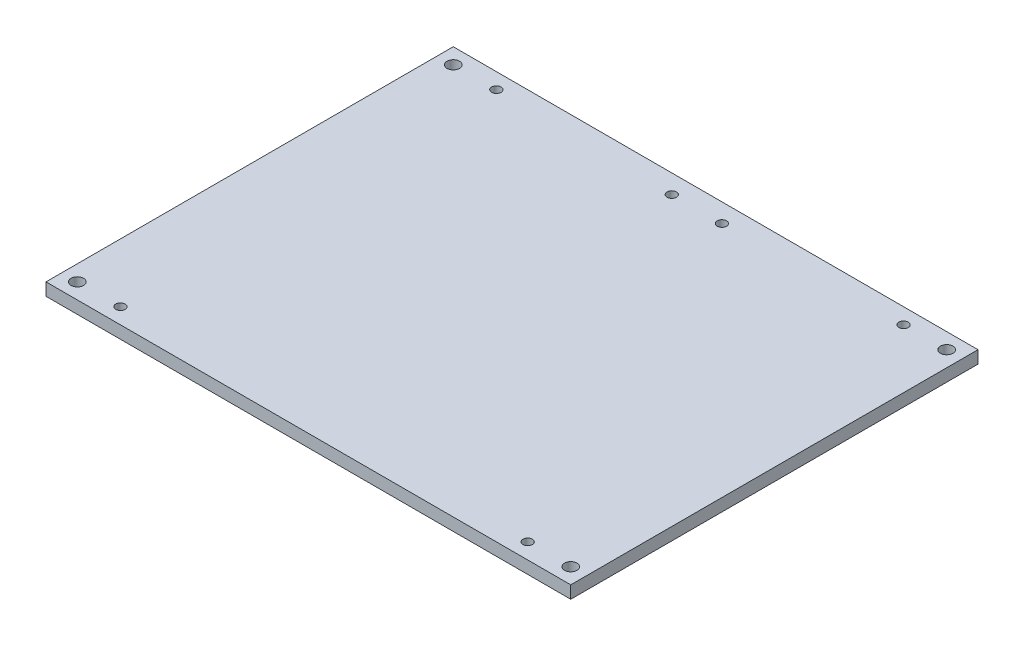
from build123d import *

# Parameters (mm, degrees)
SKETCH1_W           = 167.5
SKETCH1_H           = 130
BOSS_EXTRUDE1_DEPTH = 4
SKETCH2_R           = 1.5
CUT_EXTRUDE1_DEPTH  = 3
SKETCH3_R           = 1.5
CUT_EXTRUDE2_DEPTH  = 3
SKETCH5_R           = 2
CUT_EXTRUDE3_DEPTH  = 10


with BuildPart() as part:
    # Sketch1 → Boss-Extrude1 (new body)
    with BuildSketch(Plane(origin=(0, 0, 0), x_dir=(1, 0, 0), z_dir=(0, 1, 0))):
        Rectangle(SKETCH1_W, SKETCH1_H)
    extrude(amount=BOSS_EXTRUDE1_DEPTH)

    # Sketch2 → Cut-Extrude1 (cut)
    with BuildSketch(Plane(origin=(0, 4, 0), x_dir=(1, 0, 0), z_dir=(0, 1, 0))):
        with Locations(Location((-65, -60, 0), (0, 0, 270))):
            Circle(SKETCH2_R)
        with Locations(Location((65, -60, 0), (0, 0, 270))):
            Circle(SKETCH2_R)
        with Locations(Location((65, 60, 0), (0, 0, 270))):
            Circle(SKETCH2_R)
        with Locations(Location((-65, 60, 0), (0, 0, 270))):
            Circle(SKETCH2_R)
    extrude(amount=-CUT_EXTRUDE1_DEPTH, mode=Mode.SUBTRACT)

    # Sketch3 → Cut-Extrude2 (cut)
    with BuildSketch(Plane(origin=(0, 4, 0), x_dir=(1, 0, 0), z_dir=(0, 1, 0))):
        with Locations(Location((-8, 59, 0), (0, 0, 270))):
            Circle(SKETCH3_R)
        with Locations(Location((8, 59, 0), (0, 0, 270))):
            Circle(SKETCH3_R)
    extrude(amount=-CUT_EXTRUDE2_DEPTH, mode=Mode.SUBTRACT)

    # Sketch5 → Cut-Extrude3 (cut)
    with BuildSketch(Plane(origin=(0, 4, 0), x_dir=(1, 0, 0), z_dir=(0, 1, 0))):
        with Locations(Location((-78.75, 60, 0), (0, 0, 270))):
            Circle(SKETCH5_R)
        with Locations(Location((78.75, 60, 0), (0, 0, 270))):
            Circle(SKETCH5_R)
        with Locations(Location((78.75, -60, 0), (0, 0, 270))):
            Circle(SKETCH5_R)
        with Locations(Location((-78.75, -60, 0), (0, 0, 270))):
            Circle(SKETCH5_R)
    extrude(amount=-CUT_EXTRUDE3_DEPTH, mode=Mode.SUBTRACT)


solid = part.part
